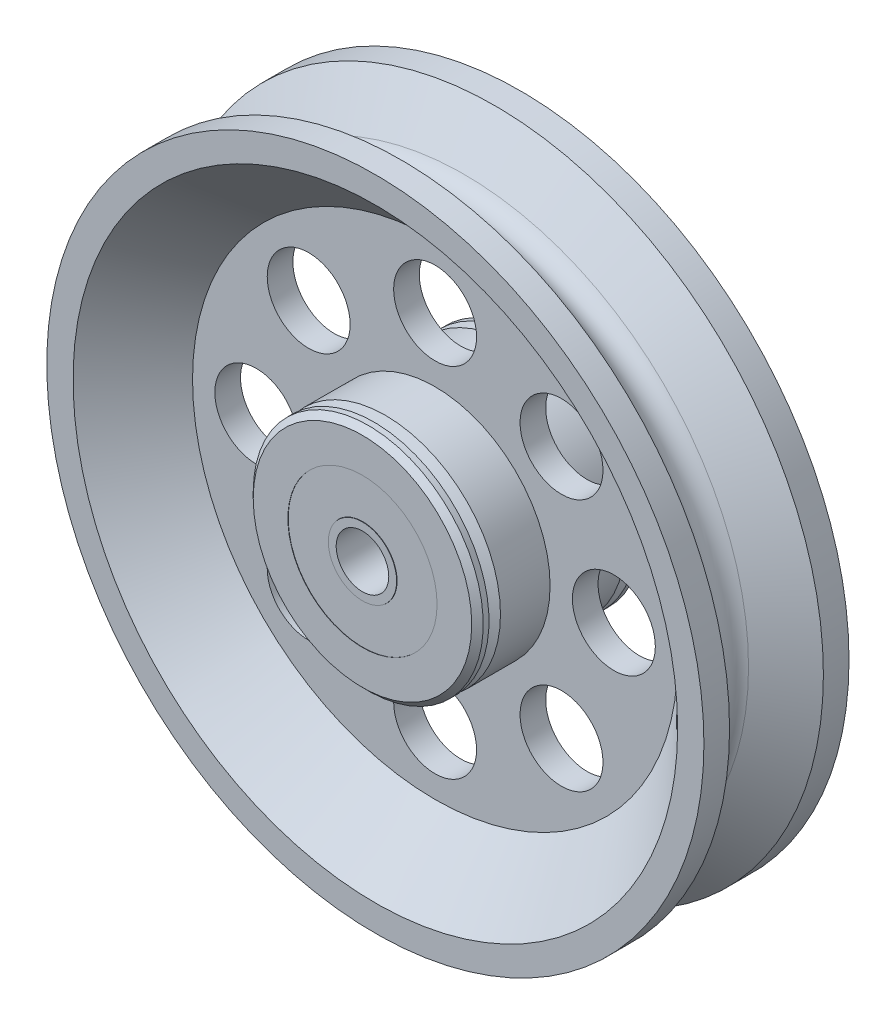
from build123d import *

# Parameters (mm, degrees)
CUT_EXTRUDE_THIN1_DEPTH      = 115.134515622
CUT_EXTRUDE_THIN1_DEPTH_BACK = 115.134515622
SKETCH2_R                    = 8.2804
SKETCH2_R_2                  = 8.255
CHAMFER1_SIZE                = 1.3890625
SKETCH4_R                    = 10.014346875
CUT_EXTRUDE1_DEPTH           = 115.134515622
CIRPATTERN1_COUNT            = 8


with BuildPart() as part:
    # Sketch1 → Revolve1 (revolve)
    with BuildSketch(Plane(origin=(0, 0, 0), x_dir=(0, 0, -1), z_dir=(1, 0, 0)), mode=Mode.PRIVATE) as revolve1_sk:
        with BuildLine():
            Line((11.33475, 79.375), (17.526, 79.375))
            Line((17.526, 79.375), (17.526, 73.025))
            Line((17.526, 73.025), (3.095625, 58.594625))
            Line((3.095625, 58.594625), (3.095625, 27.78125))
            Line((3.095625, 27.78125), (20.6375, 27.78125))
            Line((20.6375, 27.78125), (20.6375, 18.018125))
            Line((20.6375, 18.018125), (20.5613, 18.018125))
            Line((20.5613, 18.018125), (20.5613, 8.255))
            Line((20.5613, 8.255), (20.6375, 8.255))
            Line((20.6375, 8.255), (20.6375, 6.35))
            Line((20.6375, 6.35), (-20.6375, 6.35))
            Line((-20.6375, 6.35), (-20.6375, 8.255))
            Line((-20.6375, 8.255), (-20.5613, 8.255))
            Line((-20.5613, 8.255), (-20.5613, 18.018125))
            Line((-20.5613, 18.018125), (-20.6375, 18.018125))
            Line((-20.6375, 18.018125), (-20.6375, 27.78125))
            Line((-20.6375, 27.78125), (-3.095625, 27.78125))
            Line((-3.095625, 27.78125), (-3.095625, 58.594625))
            Line((-3.095625, 58.594625), (-17.526, 73.025))
            Line((-17.526, 73.025), (-17.526, 79.375))
            Line((-17.526, 79.375), (-11.33475, 79.375))
            Line((-11.33475, 79.375), (-3.907585552, 68.714967832))
            ThreePointArc((-3.907585552, 68.714967832), (0, 66.675), (3.907585552, 68.714967832))
            Line((3.907585552, 68.714967832), (11.33475, 79.375))
        make_face()
    revolve(revolve1_sk.sketch.rotate(Axis((0, 0, 20.6375), (0, 0, -1)), 90), axis=Axis((0, 0, 20.6375), (0, 0, -1)))

    # Sketch2 → Cut-Extrude-Thin1 (cut, two sides: drawn at the far end of the back side and taken through both)
    with BuildSketch(Plane.XY.offset(-CUT_EXTRUDE_THIN1_DEPTH_BACK)):
        Circle(SKETCH2_R)
        Circle(SKETCH2_R_2, mode=Mode.SUBTRACT)
    extrude(amount=CUT_EXTRUDE_THIN1_DEPTH + CUT_EXTRUDE_THIN1_DEPTH_BACK, mode=Mode.SUBTRACT)


with BuildPart() as cut_extrude_thin1_piece_1:
    # of the separate pieces the step leaves, piece 1, a body of its own (cut_extrude_thin1_pieces)
    add(part.part.solids().sort_by_distance((68.714967832, 0, -3.907585552))[0])

    # Chamfer1
    chamfer1_edges = [cut_extrude_thin1_piece_1.edges().sort_by_distance(p)[0] for p in [
        (-27.78125, 0, 20.6375),
        (-27.78125, 0, -20.6375),
    ]]
    chamfer(chamfer1_edges, length=CHAMFER1_SIZE)

    # Sketch3 → Cut-Revolve1 (revolve, cut)
    with BuildSketch(Plane(origin=(0, 0, 0), x_dir=(0, 0, -1), z_dir=(1, 0, 0)), mode=Mode.PRIVATE) as cut_revolve1_sk:
        Polygon((-17.859375, 27.78125), (-16.4703125, 25.375323175), (-15.08125, 27.78125), align=None)
    cut_revolve1 = revolve(cut_revolve1_sk.sketch.rotate(Axis((0, 0, 17.859375), (0, 0, 1)), 90), axis=Axis((0, 0, 17.859375), (0, 0, 1)), mode=Mode.SUBTRACT)

    # Mirror1: Cut-Revolve1 across plane
    add(cut_revolve1.mirror(Plane.XY), mode=Mode.SUBTRACT)

    # Sketch4 → Cut-Extrude1 (cut, symmetric)
    with BuildSketch(Plane.XY):
        with Locations((0, 43.1879375)):
            Circle(SKETCH4_R)
    cut_extrude1 = extrude(amount=CUT_EXTRUDE1_DEPTH, both=True, mode=Mode.SUBTRACT)

    # CirPattern1: Cut-Extrude1 ×8 about axis
    cirpattern1_axis = Axis((0, 0, 0), (0, 0, 1))
    for i in range(1, CIRPATTERN1_COUNT):
        add(cut_extrude1.rotate(cirpattern1_axis, i * 360 / CIRPATTERN1_COUNT), mode=Mode.SUBTRACT)


with BuildPart() as cut_extrude_thin1_piece_2:
    # of the separate pieces the step leaves, piece 2, a body of its own (cut_extrude_thin1_pieces)
    add(part.part.solids().sort_by_distance((8.255, 0, -20.5613))[0])


solid = Compound([cut_extrude_thin1_piece_1.part, cut_extrude_thin1_piece_2.part])
